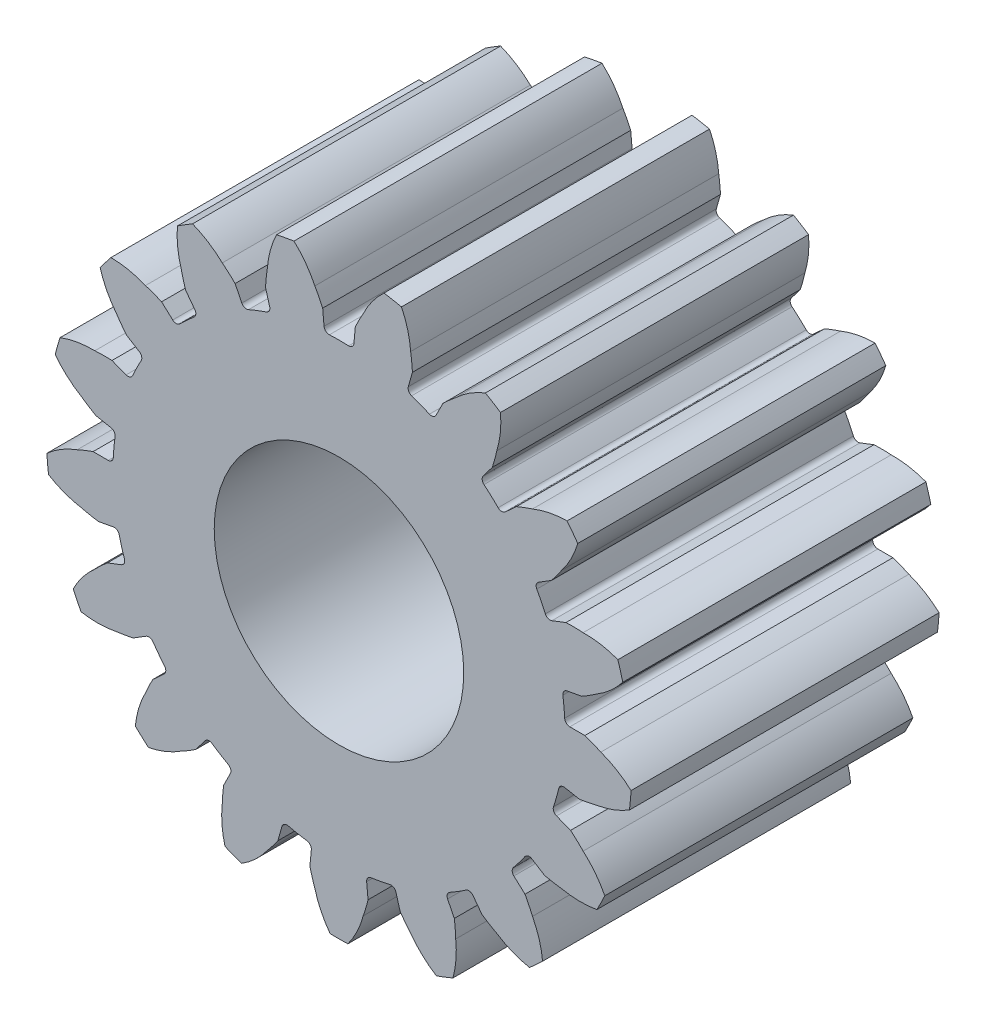
from build123d import *

# Parameters (mm, degrees)
ESBO_O1_R                = 9.5
RESSALTO_EXTRUS_O1_DEPTH = 10
CORTE_EXTRUS_O2_START    = -10
CORTE_EXTRUS_O2_DEPTH    = 10
PADR_OCIRCULAR2_COUNT    = 17
ESBO_O3_R                = 4.05
CORTE_EXTRUS_O3_DEPTH    = 10


with BuildPart() as part:
    # Esboço1 → Ressalto-extrusão1 (new body)
    with BuildSketch(Plane.XY):
        Circle(ESBO_O1_R)
    extrude(amount=RESSALTO_EXTRUS_O1_DEPTH)

    # Esboço2 → Corte-extrusão2 (cut)
    with BuildSketch(Plane.XY.offset(10).offset(CORTE_EXTRUS_O2_START)):
        with BuildLine():
            Line((0.529478325, 7.96742604), (0.484304633, 7.479542634))
            ThreePointArc((0.484304633, 7.479542634), (0.42799563, 7.369389295), (0.311275008, 7.328392243))
            ThreePointArc((0.311275008, 7.328392243), (0, 7.335), (-0.311275008, 7.328392243))
            ThreePointArc((-0.311275008, 7.328392243), (-0.42799563, 7.369389295), (-0.484304633, 7.479542634))
            Line((-0.484304633, 7.479542634), (-0.529478325, 7.96742604))
            ThreePointArc((-0.529478325, 7.96742604), (-0.650370688, 8.218788992), (-0.783672794, 8.46379684))
            ThreePointArc((-0.783672794, 8.46379684), (-1.078320405, 8.957780196), (-1.461279603, 9.386941031))
            ThreePointArc((-1.461279603, 9.386941031), (0, 9.5), (1.461279603, 9.386941031))
            ThreePointArc((1.461279603, 9.386941031), (1.078320405, 8.957780196), (0.783672794, 8.46379684))
            ThreePointArc((0.783672794, 8.46379684), (0.650370688, 8.218788992), (0.529478325, 7.96742604))
        make_face()
    corte_extrus_o2 = extrude(amount=CORTE_EXTRUS_O2_DEPTH, mode=Mode.SUBTRACT)

    # PadrãoCircular2: Corte-extrusão2 ×17 about axis
    padr_ocircular2_axis = Axis((0, 0, 0), (0, 0, 1))
    for i in range(1, PADR_OCIRCULAR2_COUNT):
        add(corte_extrus_o2.rotate(padr_ocircular2_axis, i * 360 / PADR_OCIRCULAR2_COUNT), mode=Mode.SUBTRACT)

    # Esboço3 → Corte-extrusão3 (cut)
    with BuildSketch(Plane.XY.offset(10)):
        Circle(ESBO_O3_R)
    extrude(amount=-CORTE_EXTRUS_O3_DEPTH, mode=Mode.SUBTRACT)


solid = part.part
